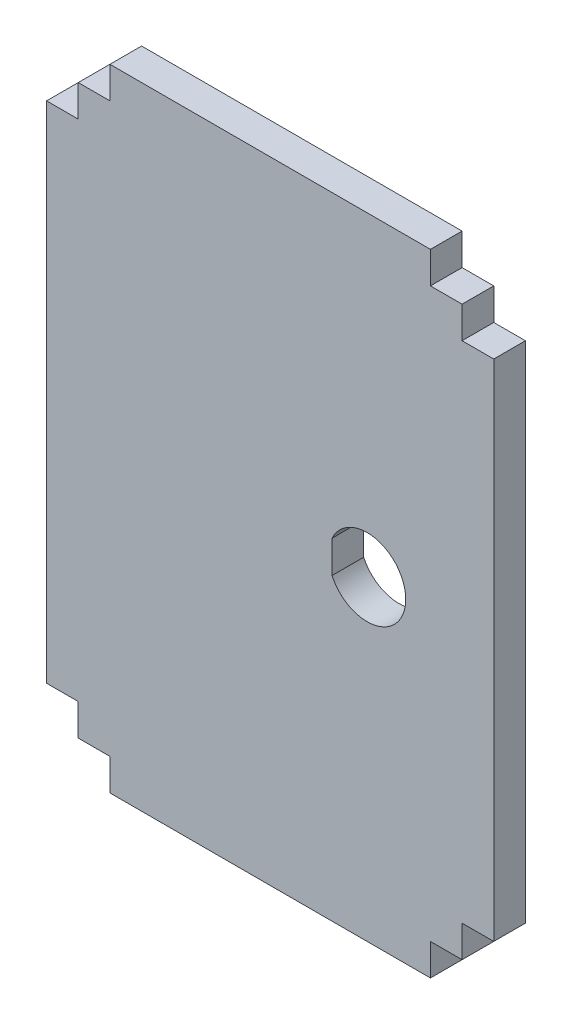
from build123d import *

# Parameters (mm, degrees)
BOSS_EXTRUDE1_DEPTH = 6.35
CUT_EXTRUDE1_DEPTH  = 101.455184316


with BuildPart() as part:
    # Sketch1 → Boss-Extrude1 (new body)
    with BuildSketch(Plane.XY):
        Polygon((-30.233286112, -35.183650292), (-23.883286112, -35.183650292), (-23.883286112, -41.533650292), (40.404113888, -41.533650292), (40.404113888, -35.183650292), (46.754113888, -35.183650292), (46.754113888, -28.833650292), (53.104113888, -28.833650292), (53.104113888, 72.334549708), (46.754113888, 72.334549708), (46.754113888, 78.684549708), (40.404113888, 78.684549708), (40.404113888, 85.034549708), (-23.883286112, 85.034549708), (-23.883286112, 78.684549708), (-30.233286112, 78.684549708), (-30.233286112, 72.334549708), (-36.583286112, 72.334549708), (-36.583286112, -28.833650292), (-30.233286112, -28.833650292), align=None)
    extrude(amount=-BOSS_EXTRUDE1_DEPTH)

    # Sketch2 → Cut-Extrude1 (cut, through all)
    with BuildSketch(Plane(origin=(0, 0, -6.35), x_dir=(-1, 0, 0), z_dir=(0, 0, -1))):
        with BuildLine():
            Line((-20.668313863, 24.992906647), (-20.668313863, 18.507992769))
            ThreePointArc((-20.668313863, 18.507992769), (-35.451113888, 21.750449708), (-20.668313863, 24.992906647))
        make_face()
    extrude(amount=-CUT_EXTRUDE1_DEPTH, mode=Mode.SUBTRACT)


solid = part.part
